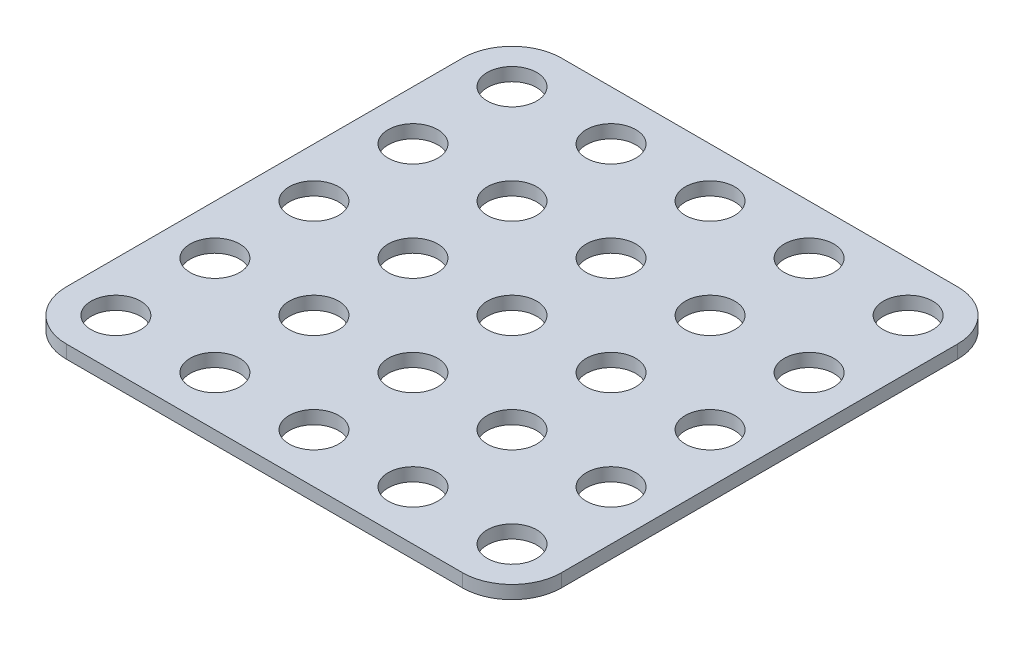
from build123d import *

# Parameters (mm, degrees)
SKETCH1_R           = 7.5
BOSS_EXTRUDE1_DEPTH = 4


with BuildPart() as part:
    # Sketch1 → Boss-Extrude1 (new body)
    with BuildSketch(Plane(origin=(0, 0, 0), x_dir=(1, 0, 0), z_dir=(0, 1, 0))):
        with BuildLine():
            ThreePointArc((-75, -60), (-70.606601718, -70.606601718), (-60, -75))
            Line((-60, -75), (60, -75))
            ThreePointArc((60, -75), (70.606601718, -70.606601718), (75, -60))
            Line((75, -60), (75, 60))
            ThreePointArc((75, 60), (70.606601718, 70.606601718), (60, 75))
            Line((60, 75), (-60, 75))
            ThreePointArc((-60, 75), (-70.606601718, 70.606601718), (-75, 60))
            Line((-75, 60), (-75, -60))
        make_face()
        with Locations(Location((-60, -60, 0), (0, 0, 270))):
            Circle(SKETCH1_R, mode=Mode.SUBTRACT)
        with Locations(Location((-30, -60, 0), (0, 0, 270))):
            Circle(SKETCH1_R, mode=Mode.SUBTRACT)
        with Locations(Location((-60, -30, 0), (0, 0, 270))):
            Circle(SKETCH1_R, mode=Mode.SUBTRACT)
        with Locations(Location((-30, -30, 0), (0, 0, 270))):
            Circle(SKETCH1_R, mode=Mode.SUBTRACT)
        with Locations(Location((0, -30, 0), (0, 0, 270))):
            Circle(SKETCH1_R, mode=Mode.SUBTRACT)
        with Locations(Location((0, -60, 0), (0, 0, 270))):
            Circle(SKETCH1_R, mode=Mode.SUBTRACT)
        with Locations(Location((30, -60, 0), (0, 0, 270))):
            Circle(SKETCH1_R, mode=Mode.SUBTRACT)
        with Locations(Location((60, -60, 0), (0, 0, 270))):
            Circle(SKETCH1_R, mode=Mode.SUBTRACT)
        with Locations(Location((30, -30, 0), (0, 0, 270))):
            Circle(SKETCH1_R, mode=Mode.SUBTRACT)
        with Locations(Location((60, -30, 0), (0, 0, 270))):
            Circle(SKETCH1_R, mode=Mode.SUBTRACT)
        with Locations(Location((-60, 0, 0), (0, 0, 270))):
            Circle(SKETCH1_R, mode=Mode.SUBTRACT)
        with Locations(Location((-60, 30, 0), (0, 0, 270))):
            Circle(SKETCH1_R, mode=Mode.SUBTRACT)
        with Locations(Location((-30, 0, 0), (0, 0, 270))):
            Circle(SKETCH1_R, mode=Mode.SUBTRACT)
        with Locations(Location((0, 0, 0), (0, 0, 270))):
            Circle(SKETCH1_R, mode=Mode.SUBTRACT)
        with Locations(Location((-30, 30, 0), (0, 0, 270))):
            Circle(SKETCH1_R, mode=Mode.SUBTRACT)
        with Locations(Location((0, 30, 0), (0, 0, 270))):
            Circle(SKETCH1_R, mode=Mode.SUBTRACT)
        with Locations(Location((-60, 60, 0), (0, 0, 270))):
            Circle(SKETCH1_R, mode=Mode.SUBTRACT)
        with Locations(Location((-30, 60, 0), (0, 0, 270))):
            Circle(SKETCH1_R, mode=Mode.SUBTRACT)
        with Locations(Location((0, 60, 0), (0, 0, 270))):
            Circle(SKETCH1_R, mode=Mode.SUBTRACT)
        with Locations(Location((30, 0, 0), (0, 0, 270))):
            Circle(SKETCH1_R, mode=Mode.SUBTRACT)
        with Locations(Location((30, 30, 0), (0, 0, 270))):
            Circle(SKETCH1_R, mode=Mode.SUBTRACT)
        with Locations(Location((60, 0, 0), (0, 0, 270))):
            Circle(SKETCH1_R, mode=Mode.SUBTRACT)
        with Locations(Location((60, 30, 0), (0, 0, 270))):
            Circle(SKETCH1_R, mode=Mode.SUBTRACT)
        with Locations(Location((30, 60, 0), (0, 0, 270))):
            Circle(SKETCH1_R, mode=Mode.SUBTRACT)
        with Locations(Location((60, 60, 0), (0, 0, 270))):
            Circle(SKETCH1_R, mode=Mode.SUBTRACT)
    extrude(amount=BOSS_EXTRUDE1_DEPTH)


solid = part.part
